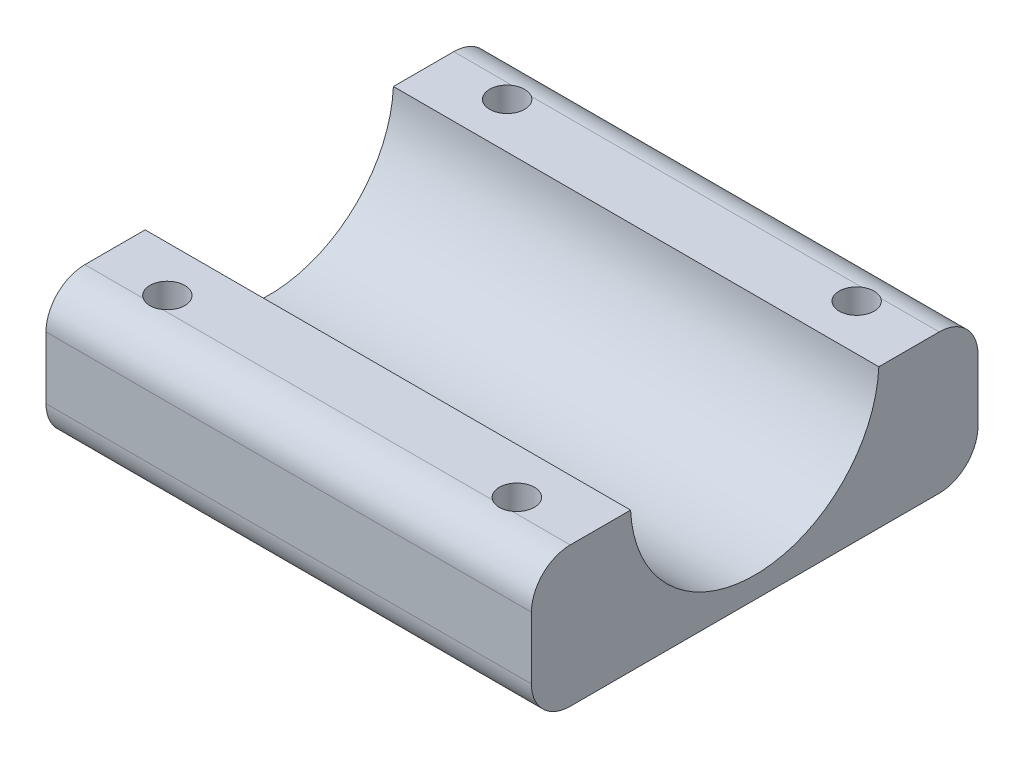
from build123d import *

# Parameters (mm, degrees)
BOSS_EXTRUDE1_DEPTH     = 25
CUT_EXTRUDE1_DEPTH      = 38.134889255
CUT_EXTRUDE1_DEPTH_BACK = 38.134889255
SKETCH2_R               = 12.8
SKETCH3_R               = 1.8
CUT_EXTRUDE2_DEPTH      = 16
SKETCH4_R               = 3.25
CUT_EXTRUDE3_DEPTH      = 5.6


with BuildPart() as part:
    # Sketch1 → Boss-Extrude1 (new, symmetric)
    with BuildSketch(Plane(origin=(0, 0, 0), x_dir=(0, 0, -1), z_dir=(1, 0, 0))):
        with BuildLine():
            Line((-19, -15), (19, -15))
            ThreePointArc((19, -15), (21.828427125, -13.828427125), (23, -11))
            Line((23, -11), (23, -4.6))
            ThreePointArc((23, -4.6), (21.828427125, -1.771572875), (19, -0.6))
            Line((19, -0.6), (-19, -0.6))
            ThreePointArc((-19, -0.6), (-21.828427125, -1.771572875), (-23, -4.6))
            Line((-23, -4.6), (-23, -11))
            ThreePointArc((-23, -11), (-21.828427125, -13.828427125), (-19, -15))
        make_face()
    extrude(amount=BOSS_EXTRUDE1_DEPTH, both=True)

    # Sketch2 → Cut-Extrude1 (cut, two sides: drawn at the far end of the back side and taken through both)
    with BuildSketch(Plane(origin=(0, 0, 0), x_dir=(0, 0, -1), z_dir=(1, 0, 0)).offset(-CUT_EXTRUDE1_DEPTH_BACK)):
        Circle(SKETCH2_R)
    extrude(amount=CUT_EXTRUDE1_DEPTH + CUT_EXTRUDE1_DEPTH_BACK, mode=Mode.SUBTRACT)

    # Sketch3 → Cut-Extrude2 (cut)
    with BuildSketch(Plane(origin=(0, -15, 0), x_dir=(1, 0, 0), z_dir=(0, 1, 0))):
        with Locations(Location((18, -17.5, 0), (0, 0, 236.442690238))):
            Circle(SKETCH3_R)
        with Locations(Location((18, 17.5, 0), (0, 0, 123.557309762))):
            Circle(SKETCH3_R)
        with Locations(Location((-18, -17.5, 0), (0, 0, 236.442690238))):
            Circle(SKETCH3_R)
        with Locations(Location((-18, 17.5, 0), (0, 0, 123.557309762))):
            Circle(SKETCH3_R)
    extrude(amount=CUT_EXTRUDE2_DEPTH, mode=Mode.SUBTRACT)

    # Sketch4 → Cut-Extrude3 (cut)
    with BuildSketch(Plane(origin=(0, -15, 0), x_dir=(1, 0, 0), z_dir=(0, 1, 0))):
        with Locations(Location((18, -17.5, 0), (0, 0, 207.48642625))):
            Circle(SKETCH4_R)
        with Locations(Location((18, 17.5, 0), (0, 0, 27.48642625))):
            Circle(SKETCH4_R)
        with Locations(Location((-18, -17.5, 0), (0, 0, 207.48642625))):
            Circle(SKETCH4_R)
        with Locations(Location((-18, 17.5, 0), (0, 0, 27.48642625))):
            Circle(SKETCH4_R)
    extrude(amount=CUT_EXTRUDE3_DEPTH, mode=Mode.SUBTRACT)


solid = part.part
